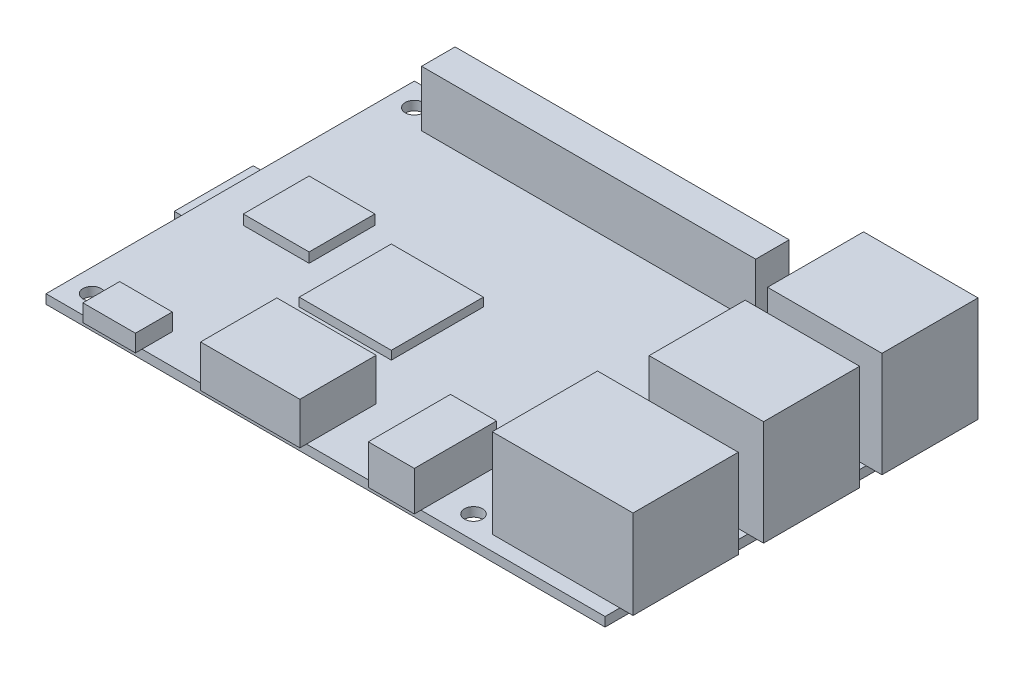
from build123d import *

# Parameters (mm, degrees)
SKETCH1_W               = 85
SKETCH1_H               = 56
PCB_DEPTH               = 1.4
M2_5_HOLE_1_DEPTH       = 102.798624745
M2_5_HOLE_1_DEPTH_BACK  = 102.798624745
SKETCH2_R               = 1.375
M2_5_HOLE_2_DEPTH       = 102.798624745
M2_5_HOLE_2_DEPTH_BACK  = 102.798624745
SKETCH3_R               = 1.375
M2_5_HOLE_3_DEPTH       = 102.798624745
M2_5_HOLE_3_DEPTH_BACK  = 102.798624745
SKETCH4_R               = 1.375
M2_5_HOLE_4_DEPTH       = 102.798624745
M2_5_HOLE_4_DEPTH_BACK  = 102.798624745
SKETCH5_R               = 1.375
GPIO_HEADER_40PIN_START = 1.4
SKETCH6_W               = 50.8
SKETCH6_H               = 5.1
GPIO_HEADER_40PIN_DEPTH = 8.5
USB_PAIR_1_START        = 1.4
SKETCH7_W               = 17.4
SKETCH7_H               = 14.6
USB_PAIR_1_DEPTH        = 16
USB_PAIR_2_START        = 1.4
SKETCH8_W               = 17.4
SKETCH8_H               = 14.6
USB_PAIR_2_DEPTH        = 16
ETHERNET_RJ45_START     = 1.4
SKETCH9_W               = 21.4
SKETCH9_H               = 16
ETHERNET_RJ45_DEPTH     = 13.5
SOC_BCM2837B0_START     = 1.4
SKETCH10_W              = 14
SKETCH10_H              = 14
SOC_BCM2837B0_DEPTH     = 1.3
HDMI_START              = 1.4
SKETCH11_W              = 15.1
SKETCH11_H              = 11.6
HDMI_DEPTH              = 6.4
MICRO_USB_POWER_START   = 1.4
SKETCH12_W              = 8
SKETCH12_H              = 5.6
MICRO_USB_POWER_DEPTH   = 2.6
AUDIO_JACK_START        = 1.4
SKETCH13_W              = 7
SKETCH13_H              = 12.5
AUDIO_JACK_DEPTH        = 6
WIFI_SHIELD_START       = 1.4
SKETCH14_W              = 10
SKETCH14_H              = 10
WIFI_SHIELD_DEPTH       = 1.5
LAN_CHIP_START          = 1.4
SKETCH15_W              = 9
SKETCH15_H              = 9
LAN_CHIP_DEPTH          = 1
SKETCH16_W              = 13
SKETCH16_H              = 12
MICROSD_SLOT_DEPTH      = 1.5


with BuildPart() as part:
    # Sketch1 → PCB (new body)
    with BuildSketch(Plane(origin=(0, 0, 0), x_dir=(1, 0, 0), z_dir=(0, 1, 0))):
        with Locations((42.5, 28)):
            Rectangle(SKETCH1_W, SKETCH1_H)
    extrude(amount=PCB_DEPTH)

    # Sketch2 → M2_5_hole_1 (cut, two sides: drawn at the far end of the back side and taken through both)
    with BuildSketch(Plane(origin=(0, 0, 0), x_dir=(1, 0, 0), z_dir=(0, 1, 0)).offset(-M2_5_HOLE_1_DEPTH_BACK)):
        with Locations(Location((3.5, 3.5, 0), (0, 0, 270))):
            Circle(SKETCH2_R)
    extrude(amount=M2_5_HOLE_1_DEPTH + M2_5_HOLE_1_DEPTH_BACK, mode=Mode.SUBTRACT)

    # Sketch3 → M2_5_hole_2 (cut, two sides: drawn at the far end of the back side and taken through both)
    with BuildSketch(Plane(origin=(0, 0, 0), x_dir=(1, 0, 0), z_dir=(0, 1, 0)).offset(-M2_5_HOLE_2_DEPTH_BACK)):
        with Locations(Location((61.5, 3.5, 0), (0, 0, 270))):
            Circle(SKETCH3_R)
    extrude(amount=M2_5_HOLE_2_DEPTH + M2_5_HOLE_2_DEPTH_BACK, mode=Mode.SUBTRACT)

    # Sketch4 → M2_5_hole_3 (cut, two sides: drawn at the far end of the back side and taken through both)
    with BuildSketch(Plane(origin=(0, 0, 0), x_dir=(1, 0, 0), z_dir=(0, 1, 0)).offset(-M2_5_HOLE_3_DEPTH_BACK)):
        with Locations(Location((3.5, 52.5, 0), (0, 0, 270))):
            Circle(SKETCH4_R)
    extrude(amount=M2_5_HOLE_3_DEPTH + M2_5_HOLE_3_DEPTH_BACK, mode=Mode.SUBTRACT)

    # Sketch5 → M2_5_hole_4 (cut, two sides: drawn at the far end of the back side and taken through both)
    with BuildSketch(Plane(origin=(0, 0, 0), x_dir=(1, 0, 0), z_dir=(0, 1, 0)).offset(-M2_5_HOLE_4_DEPTH_BACK)):
        with Locations(Location((61.5, 52.5, 0), (0, 0, 270))):
            Circle(SKETCH5_R)
    extrude(amount=M2_5_HOLE_4_DEPTH + M2_5_HOLE_4_DEPTH_BACK, mode=Mode.SUBTRACT)

    # Sketch6 → GPIO_header_40pin (add)
    with BuildSketch(Plane(origin=(0, 0, 0), x_dir=(1, 0, 0), z_dir=(0, 1, 0)).offset(GPIO_HEADER_40PIN_START)):
        with Locations((32.5, 52.55)):
            Rectangle(SKETCH6_W, SKETCH6_H)
    extrude(amount=GPIO_HEADER_40PIN_DEPTH)

    # Sketch7 → USB_pair_1 (add)
    with BuildSketch(Plane(origin=(0, 0, 0), x_dir=(1, 0, 0), z_dir=(0, 1, 0)).offset(USB_PAIR_1_START)):
        with Locations((78.7, 29)):
            Rectangle(SKETCH7_W, SKETCH7_H)
    extrude(amount=USB_PAIR_1_DEPTH)

    # Sketch8 → USB_pair_2 (add)
    with BuildSketch(Plane(origin=(0, 0, 0), x_dir=(1, 0, 0), z_dir=(0, 1, 0)).offset(USB_PAIR_2_START)):
        with Locations((78.7, 47)):
            Rectangle(SKETCH8_W, SKETCH8_H)
    extrude(amount=USB_PAIR_2_DEPTH)

    # Sketch9 → Ethernet_RJ45 (add)
    with BuildSketch(Plane(origin=(0, 0, 0), x_dir=(1, 0, 0), z_dir=(0, 1, 0)).offset(ETHERNET_RJ45_START)):
        with Locations((76.3, 10.25)):
            Rectangle(SKETCH9_W, SKETCH9_H)
    extrude(amount=ETHERNET_RJ45_DEPTH)

    # Sketch10 → SoC_BCM2837B0 (add)
    with BuildSketch(Plane(origin=(0, 0, 0), x_dir=(1, 0, 0), z_dir=(0, 1, 0)).offset(SOC_BCM2837B0_START)):
        with Locations((28, 24.5)):
            Rectangle(SKETCH10_W, SKETCH10_H)
    extrude(amount=SOC_BCM2837B0_DEPTH)

    # Sketch11 → HDMI (add)
    with BuildSketch(Plane(origin=(0, 0, 0), x_dir=(1, 0, 0), z_dir=(0, 1, 0)).offset(HDMI_START)):
        with Locations((32.05, 4.8)):
            Rectangle(SKETCH11_W, SKETCH11_H)
    extrude(amount=HDMI_DEPTH)

    # Sketch12 → Micro_USB_power (add)
    with BuildSketch(Plane(origin=(0, 0, 0), x_dir=(1, 0, 0), z_dir=(0, 1, 0)).offset(MICRO_USB_POWER_START)):
        with Locations((10.6, 1.8)):
            Rectangle(SKETCH12_W, SKETCH12_H)
    extrude(amount=MICRO_USB_POWER_DEPTH)

    # Sketch13 → Audio_jack (add)
    with BuildSketch(Plane(origin=(0, 0, 0), x_dir=(1, 0, 0), z_dir=(0, 1, 0)).offset(AUDIO_JACK_START)):
        with Locations((53.5, 5.25)):
            Rectangle(SKETCH13_W, SKETCH13_H)
    extrude(amount=AUDIO_JACK_DEPTH)

    # Sketch14 → WiFi_shield (add)
    with BuildSketch(Plane(origin=(0, 0, 0), x_dir=(1, 0, 0), z_dir=(0, 1, 0)).offset(WIFI_SHIELD_START)):
        with Locations((11, 29)):
            Rectangle(SKETCH14_W, SKETCH14_H)
    extrude(amount=WIFI_SHIELD_DEPTH)

    # Sketch15 → LAN_chip (add)
    with BuildSketch(Plane(origin=(0, 0, 0), x_dir=(1, 0, 0), z_dir=(0, 1, 0)).offset(LAN_CHIP_START)):
        with Locations((59.5, 16.5)):
            Rectangle(SKETCH15_W, SKETCH15_H)
    extrude(amount=LAN_CHIP_DEPTH)

    # Sketch16 → MicroSD_slot (add)
    with BuildSketch(Plane(origin=(0, 0, 0), x_dir=(1, 0, 0), z_dir=(0, 1, 0))):
        with Locations((4, 28)):
            Rectangle(SKETCH16_W, SKETCH16_H)
    extrude(amount=-MICROSD_SLOT_DEPTH)


solid = part.part
